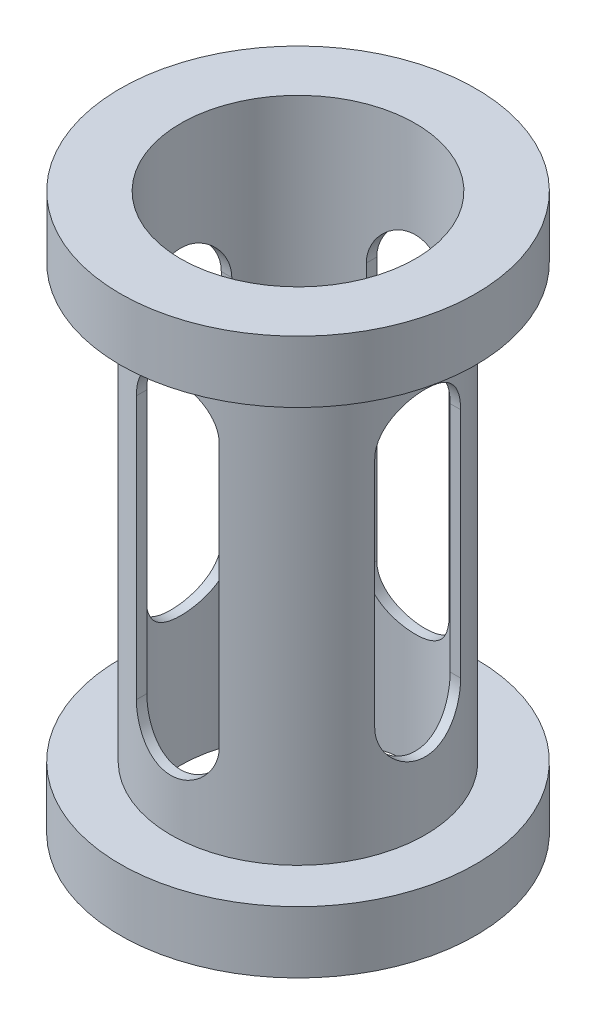
from build123d import *

# Parameters (mm, degrees)
ESBO_O1_R                  = 20.588327932
RESSALTO_EXTRUS_O1_DEPTH   = 70
ESBO_O2_R                  = 28.781927243
RESSALTO_EXTRUS_O2_DEPTH   = 10
ESBO_O4_R                  = 28.78
RESSALTO_EXTRUS_O3_DEPTH   = 10
ESBO_O5_R                  = 19
CORTE_EXTRUS_O4_DEPTH      = 90
CORTE_EXTRUS_O5_DEPTH      = 90.759671744
CORTE_EXTRUS_O5_DEPTH_BACK = 90.759671744
CORTE_EXTRUS_O6_DEPTH      = 90.759671833
CORTE_EXTRUS_O6_DEPTH_BACK = 90.759671833


with BuildPart() as part:
    # Esboço1 → Ressalto-extrusão1 (new body)
    with BuildSketch(Plane(origin=(0, 0, 0), x_dir=(1, 0, 0), z_dir=(0, 1, 0))):
        with Locations(Location((0, 0, 0), (0, 0, 270))):
            Circle(ESBO_O1_R)
    extrude(amount=RESSALTO_EXTRUS_O1_DEPTH)

    # Esboço2 → Ressalto-extrusão2 (add)
    with BuildSketch(Plane.XZ):
        with Locations(Location((0, 0, 0), (0, 0, 270))):
            Circle(ESBO_O2_R)
    extrude(amount=RESSALTO_EXTRUS_O2_DEPTH)

    # Esboço4 → Ressalto-extrusão3 (add)
    with BuildSketch(Plane(origin=(0, 70, 0), x_dir=(1, 0, 0), z_dir=(0, 1, 0))):
        with Locations(Location((0, 0, 0), (0, 0, 270))):
            Circle(ESBO_O4_R)
    extrude(amount=RESSALTO_EXTRUS_O3_DEPTH)

    # Esboço5 → Corte-extrusão4 (cut)
    with BuildSketch(Plane(origin=(0, 80, 0), x_dir=(1, 0, 0), z_dir=(0, 1, 0))):
        with Locations(Location((0, 0, 0), (0, 0, 270))):
            Circle(ESBO_O5_R)
    extrude(amount=-CORTE_EXTRUS_O4_DEPTH, mode=Mode.SUBTRACT)

    # Esboço6 → Corte-extrusão5 (cut, two sides: drawn at the far end of the back side and taken through both)
    with BuildSketch(Plane(origin=(0, 0, 0), x_dir=(0, 0, -1), z_dir=(1, 0, 0)).offset(-CORTE_EXTRUS_O5_DEPTH_BACK)):
        with BuildLine():
            Line((6.956334081, 55.558451616), (6.956334081, 17.919715425))
            ThreePointArc((6.956334081, 17.919715425), (0, 10.963381344), (-6.956334081, 17.919715425))
            Line((-6.956334081, 17.919715425), (-6.956334081, 55.558451616))
            ThreePointArc((-6.956334081, 55.558451616), (0, 62.514785697), (6.956334081, 55.558451616))
        make_face()
    extrude(amount=CORTE_EXTRUS_O5_DEPTH + CORTE_EXTRUS_O5_DEPTH_BACK, mode=Mode.SUBTRACT)

    # Esboço7 → Corte-extrusão6 (cut, two sides: drawn at the far end of the back side and taken through both)
    with BuildSketch(Plane.XY.offset(-CORTE_EXTRUS_O6_DEPTH_BACK)):
        with BuildLine():
            Line((6.707893579, 57.67019589), (6.707893579, 15.062649642))
            ThreePointArc((6.707893579, 15.062649642), (0, 8.354756063), (-6.707893579, 15.062649642))
            Line((-6.707893579, 15.062649642), (-6.707893579, 57.67019589))
            ThreePointArc((-6.707893579, 57.67019589), (0, 64.378089469), (6.707893579, 57.67019589))
        make_face()
    extrude(amount=CORTE_EXTRUS_O6_DEPTH + CORTE_EXTRUS_O6_DEPTH_BACK, mode=Mode.SUBTRACT)


solid = part.part
